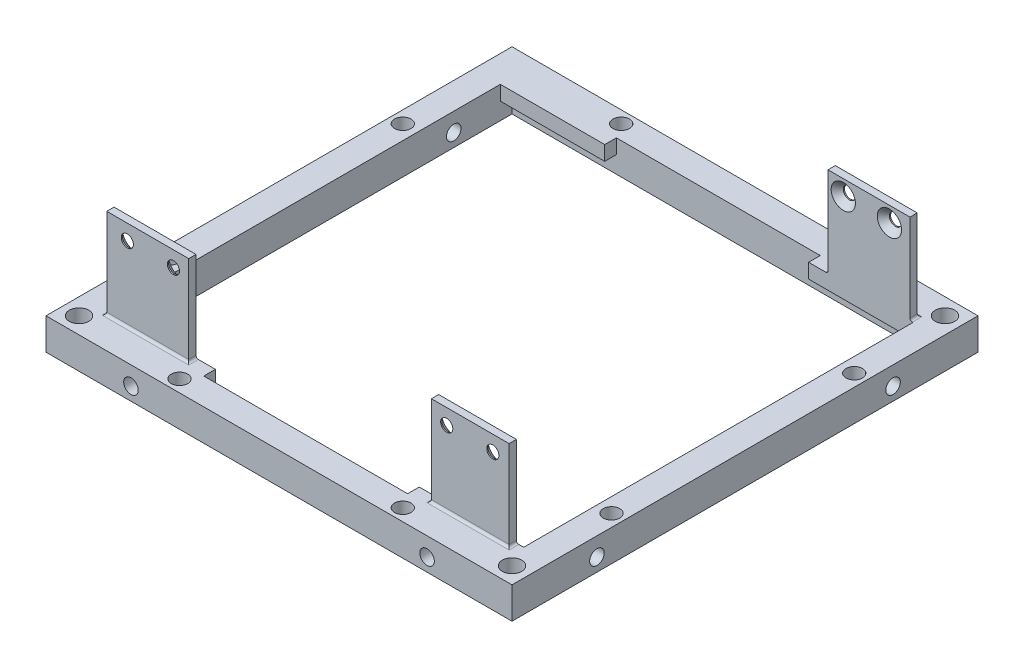
from build123d import *

# Parameters (mm, degrees)
SKETCH1_W                                            = 96
SKETCH1_H                                            = 96
SKETCH1_W_2                                          = 80
SKETCH1_H_2                                          = 80
BOSS_EXTRUDE1_DEPTH                                  = 8
F_3_0_3_DIAMETER_HOLE3_D                             = 3
F_3_0_3_DIAMETER_HOLE3_DEPTH                         = 7.5
SKETCH27_W                                           = 82
SKETCH27_H                                           = 82
CUT_EXTRUDE2_DEPTH                                   = 10
F_3_0_3_DIAMETER_HOLE1_D                             = 3
F_3_4_3_4_DIAMETER_HOLE1_D                           = 3.4
SKETCH38_W                                           = 85
SKETCH38_H                                           = 85
CUT_EXTRUDE4_DEPTH                                   = 10
F_3_0_3_DIAMETER_HOLE7_D                             = 3
SKETCH44_W                                           = 4
SKETCH44_H                                           = 4
BOSS_EXTRUDE2_DEPTH                                  = 8
SKETCH45_W                                           = 4
SKETCH45_H                                           = 3.5
BOSS_EXTRUDE3_DEPTH                                  = 8
SKETCH49_W                                           = 96
SKETCH49_H                                           = 1.5
CUT_EXTRUDE5_DEPTH                                   = 146
TAP_DRILL_FOR_M4_TAP1_D                              = 4
SKETCH53_W                                           = 4
SKETCH53_H                                           = 6.5
BOSS_EXTRUDE5_DEPTH                                  = 78
SKETCH54_W                                           = 16
SKETCH54_H                                           = 1.5
SKETCH54_W_2                                         = 16.883483494
BOSS_EXTRUDE6_DEPTH                                  = 18.5
FILLET1_R                                            = 0.5
SKETCH57_W                                           = 4
SKETCH57_H                                           = 6.5
CUT_EXTRUDE6_DEPTH                                   = 7.5
SKETCH58_W                                           = 4
SKETCH58_H                                           = 6.5
BOSS_EXTRUDE7_DEPTH                                  = 81
FILLET2_R                                            = 0.5
SKETCH61_W                                           = 32
SKETCH61_H                                           = 85
CUT_EXTRUDE7_DEPTH                                   = 81
CSK_FOR_M2_5_COUNTERSUNK_FLAT_HEAD_SCREW_D           = 2.5
CSK_FOR_M2_5_COUNTERSUNK_FLAT_HEAD_SCREW_DEPTH       = 7.901
CSK_FOR_M2_5_COUNTERSUNK_FLAT_HEAD_SCREW_CSINK_D     = 5
CSK_FOR_M2_5_COUNTERSUNK_FLAT_HEAD_SCREW_CSINK_ANGLE = 90
CSK_FOR_M2_5_COUNTERSUNK_FLAT_HEAD_S_2_D             = 2.5
CSK_FOR_M2_5_COUNTERSUNK_FLAT_HEAD_S_2_DEPTH         = 7.901
CSK_FOR_M2_5_COUNTERSUNK_FLAT_HEAD_S_2_CSINK_D       = 5
CSK_FOR_M2_5_COUNTERSUNK_FLAT_HEAD_S_2_CSINK_ANGLE   = 90
SKETCH66_W                                           = 85
SKETCH66_H                                           = 80.198
CUT_EXTRUDE8_DEPTH                                   = 10
SKETCH67_W                                           = 85
SKETCH67_H                                           = 85
CUT_EXTRUDE9_DEPTH                                   = 3.5
SKETCH68_W                                           = 42
SKETCH68_H                                           = 85
CUT_EXTRUDE10_DEPTH                                  = 56


with BuildPart() as part:
    # Sketch1 → Boss-Extrude1 (new body)
    with BuildSketch(Plane(origin=(0, 0, 0), x_dir=(1, 0, 0), z_dir=(0, 1, 0))):
        Rectangle(SKETCH1_W, SKETCH1_H)
        Rectangle(SKETCH1_W_2, SKETCH1_H_2, mode=Mode.SUBTRACT)
    extrude(amount=BOSS_EXTRUDE1_DEPTH)

    # Ø3.0 (3) Diameter Hole3
    with Locations(Plane(origin=(0, 0, -48), x_dir=(-1, 0, 0), z_dir=(0, 0, -1))):
        with Locations((45, 4)):
            Hole(F_3_0_3_DIAMETER_HOLE3_D / 2, depth=F_3_0_3_DIAMETER_HOLE3_DEPTH)

    # Sketch27 → Cut-Extrude2 (cut)
    with BuildSketch(Plane(origin=(0, 8, 0), x_dir=(1, 0, 0), z_dir=(0, 1, 0))):
        Rectangle(SKETCH27_W, SKETCH27_H)
    extrude(amount=-CUT_EXTRUDE2_DEPTH, mode=Mode.SUBTRACT)

    # Ø3.0 (3) Diameter Hole1 (through all)
    with Locations(Plane.XY.offset(48)):
        with Locations((-30.5, 2.7), (30.5, 2.7)):
            Hole(F_3_0_3_DIAMETER_HOLE1_D / 2)

    # Ø3.4 (3.4) Diameter Hole1 (through all)
    with Locations(Plane(origin=(0, 0, 0), x_dir=(-1, 0, 0), z_dir=(0, -1, 0))):
        with Locations((-23, 45.5), (23, 45.5), (45.5, 23), (45.5, -25), (23, -45.5), (-23, -45.5), (-45.5, -25), (-45.5, 25)):
            Hole(F_3_4_3_4_DIAMETER_HOLE1_D / 2)

    # Sketch38 → Cut-Extrude4 (cut)
    with BuildSketch(Plane(origin=(0, 8, 0), x_dir=(1, 0, 0), z_dir=(0, 1, 0))):
        Rectangle(SKETCH38_W, SKETCH38_H)
    extrude(amount=-CUT_EXTRUDE4_DEPTH, mode=Mode.SUBTRACT)

    # Ø3.0 (3) Diameter Hole7 (through all)
    with Locations(Plane.ZY.offset(48)):
        with Locations((-30.5, 2.7), (30.5, 2.7)):
            Hole(F_3_0_3_DIAMETER_HOLE7_D / 2)

    # Sketch44 → Boss-Extrude2 (add)
    with BuildSketch(Plane.XZ):
        with Locations((40.5, -40.5)):
            Rectangle(SKETCH44_W, SKETCH44_H)
        with Locations((-40.5, -40.5)):
            Rectangle(SKETCH44_W, SKETCH44_H)
        with Locations((-40.5, 40.5)):
            Rectangle(SKETCH44_W, SKETCH44_H)
        with Locations((40.5, 40.5)):
            Rectangle(SKETCH44_W, SKETCH44_H)
    extrude(amount=-BOSS_EXTRUDE2_DEPTH)

    # Sketch45 → Boss-Extrude3 (add)
    with BuildSketch(Plane(origin=(0, 8, 0), x_dir=(1, 0, 0), z_dir=(0, 1, 0))):
        with Locations((-40.5, 36.75)):
            Rectangle(SKETCH45_W, SKETCH45_H)
    extrude(amount=-BOSS_EXTRUDE3_DEPTH)

    # Sketch49 → Cut-Extrude5 (cut)
    with BuildSketch(Plane(origin=(48, 0, 0), x_dir=(0, 0, -1), z_dir=(1, 0, 0))):
        with Locations((0, 7.25)):
            Rectangle(SKETCH49_W, SKETCH49_H)
    extrude(amount=-CUT_EXTRUDE5_DEPTH, mode=Mode.SUBTRACT)

    # Tap Drill for M4 Tap1 (through all)
    with Locations(Plane(origin=(0, 6.5, 0), x_dir=(1, 0, 0), z_dir=(0, 1, 0))):
        with Locations((44.6, -44.6), (-44.6, -44.6), (44.6, 44.6)):
            Hole(TAP_DRILL_FOR_M4_TAP1_D / 2)

    # Sketch53 → Boss-Extrude5 (add)
    with BuildSketch(Plane(origin=(-38.5, 0, 0), x_dir=(0, 0, -1), z_dir=(1, 0, 0))):
        with Locations((-40.5, 3.25)):
            Rectangle(SKETCH53_W, SKETCH53_H)
    extrude(amount=BOSS_EXTRUDE5_DEPTH)

    # Sketch54 → Boss-Extrude6 (add)
    with BuildSketch(Plane(origin=(0, 6.5, 0), x_dir=(1, 0, 0), z_dir=(0, 1, 0))):
        with Locations((33, -40.849)):
            Rectangle(SKETCH54_W, SKETCH54_H)
        with Locations((-33.441741747, -40.849)):
            Rectangle(SKETCH54_W_2, SKETCH54_H)
        with Locations((33.441741747, 40.849)):
            Rectangle(SKETCH54_W_2, SKETCH54_H)
    extrude(amount=BOSS_EXTRUDE6_DEPTH)

    # Fillet1
    fillet1_edges = [part.edges().sort_by_distance(p)[0] for p in [
        (41, 6.5, 40.849),
        (25, 6.5, 40.849),
        (33, 6.5, 41.599),
        (-41.883483494, 6.5, 40.849),
        (-33.441741747, 6.5, 41.599),
        (-25, 6.5, 40.849),
    ]]
    fillet(fillet1_edges, radius=FILLET1_R)

    # Sketch57 → Cut-Extrude6 (cut)
    with BuildSketch(Plane.XY.offset(-35)):
        with Locations((-40.5, 3.25)):
            Rectangle(SKETCH57_W, SKETCH57_H)
    extrude(amount=-CUT_EXTRUDE6_DEPTH, mode=Mode.SUBTRACT)

    # Sketch58 → Boss-Extrude7 (add)
    with BuildSketch(Plane.ZY.offset(-38.5)):
        with Locations((-40.5, 3.25)):
            Rectangle(SKETCH58_W, SKETCH58_H)
    extrude(amount=BOSS_EXTRUDE7_DEPTH)

    # Fillet2
    fillet2_edges = [part.edges().sort_by_distance(p)[0] for p in [
        (41.883483494, 6.5, -40.849),
        (33.441741747, 6.5, -41.599),
        (25, 6.5, -40.849),
    ]]
    fillet(fillet2_edges, radius=FILLET2_R)

    # Sketch61 → Cut-Extrude7 (cut)
    with BuildSketch(Plane(origin=(0, 6.5, 0), x_dir=(1, 0, 0), z_dir=(0, 1, 0))):
        Rectangle(SKETCH61_W, SKETCH61_H)
    extrude(amount=-CUT_EXTRUDE7_DEPTH, mode=Mode.SUBTRACT)

    # CSK for M2.5 Countersunk Flat Head Screw
    with Locations(Plane.XY.offset(-40.099)):
        with Locations((28.15, 21.825324496), (37.65, 21.825324496)):
            CounterSinkHole(CSK_FOR_M2_5_COUNTERSUNK_FLAT_HEAD_SCREW_D / 2, CSK_FOR_M2_5_COUNTERSUNK_FLAT_HEAD_SCREW_CSINK_D / 2, depth=CSK_FOR_M2_5_COUNTERSUNK_FLAT_HEAD_SCREW_DEPTH, counter_sink_angle=CSK_FOR_M2_5_COUNTERSUNK_FLAT_HEAD_SCREW_CSINK_ANGLE)

    # CSK for M2.5 Countersunk Flat Head S 2
    with Locations(Plane(origin=(0, 0, 40.099), x_dir=(-1, 0, 0), z_dir=(0, 0, -1))):
        with Locations((-28.15, 21.825324496), (-37.65, 21.825324496), (28.15, 21.825324496), (37.65, 21.825324496)):
            CounterSinkHole(CSK_FOR_M2_5_COUNTERSUNK_FLAT_HEAD_S_2_D / 2, CSK_FOR_M2_5_COUNTERSUNK_FLAT_HEAD_S_2_CSINK_D / 2, depth=CSK_FOR_M2_5_COUNTERSUNK_FLAT_HEAD_S_2_DEPTH, counter_sink_angle=CSK_FOR_M2_5_COUNTERSUNK_FLAT_HEAD_S_2_CSINK_ANGLE)

    # Sketch66 → Cut-Extrude8 (cut)
    with BuildSketch(Plane(origin=(0, 6.5, 0), x_dir=(1, 0, 0), z_dir=(0, 1, 0))):
        Rectangle(SKETCH66_W, SKETCH66_H)
    extrude(amount=-CUT_EXTRUDE8_DEPTH, mode=Mode.SUBTRACT)

    # Sketch67 → Cut-Extrude9 (cut)
    with BuildSketch(Plane.XZ):
        Rectangle(SKETCH67_W, SKETCH67_H)
    extrude(amount=-CUT_EXTRUDE9_DEPTH, mode=Mode.SUBTRACT)

    # Sketch68 → Cut-Extrude10 (cut)
    with BuildSketch(Plane(origin=(0, 6.5, 0), x_dir=(1, 0, 0), z_dir=(0, 1, 0))):
        Rectangle(SKETCH68_W, SKETCH68_H)
    extrude(amount=-CUT_EXTRUDE10_DEPTH, mode=Mode.SUBTRACT)


solid = part.part
